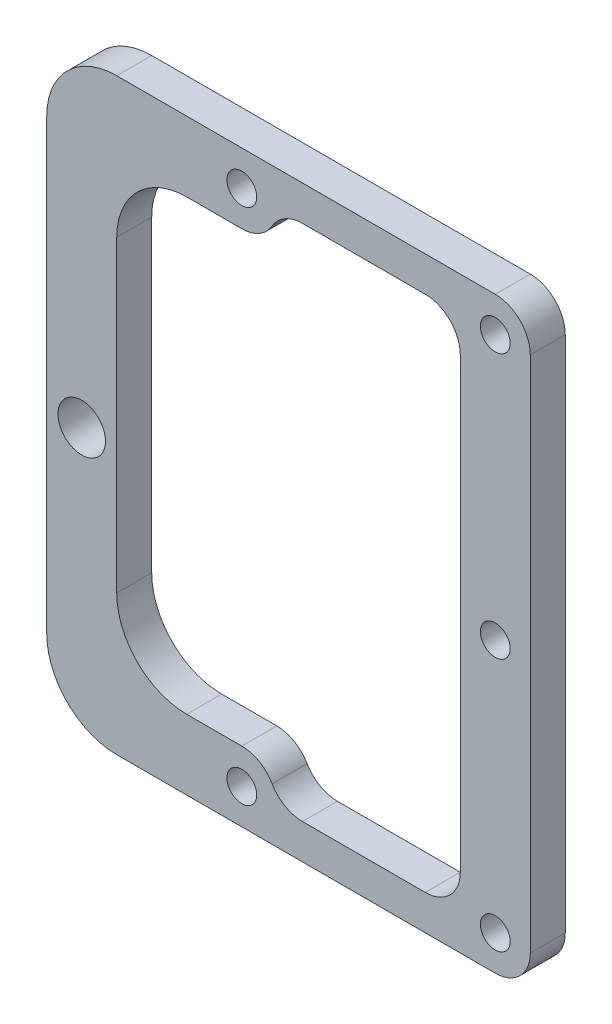
from build123d import *

# Parameters (mm, degrees)
BOSS_EXTRUDE1_DEPTH   = 3.175
F_6_CLEARANCE_HOLE1_D = 4.3053
F_2_CLEARANCE_HOLE1_D = 2.7051
FILLET1_R             = 3.175
FILLET2_R             = 6.35


with BuildPart() as part:
    # Sketch1 → Boss-Extrude1 (new body)
    with BuildSketch(Plane.XY):
        with BuildLine():
            Line((0, 3.175), (-40.698258, 3.175))
            Line((-40.698258, 3.175), (-40.698258, -50.175))
            Line((-40.698258, -50.175), (0, -50.175))
            ThreePointArc((0, -50.175), (2.24506403, -49.24506403), (3.175, -47))
            Line((3.175, -47), (3.175, 0))
            ThreePointArc((3.175, 0), (2.24506403, 2.24506403), (0, 3.175))
        make_face()
        with BuildLine():
            Line((-34.348258, -3.175), (-23, -3.175))
            ThreePointArc((-23, -3.175), (-20.75493597, -2.24506403), (-19.825, 0))
            Line((-19.825, 0), (-3.175, 0))
            Line((-3.175, 0), (-3.175, -47))
            Line((-3.175, -47), (-19.825, -47))
            ThreePointArc((-19.825, -47), (-20.75493597, -44.75493597), (-23, -43.825))
            Line((-23, -43.825), (-34.348258, -43.825))
            Line((-34.348258, -43.825), (-34.348258, -3.175))
        make_face(mode=Mode.SUBTRACT)
    extrude(amount=BOSS_EXTRUDE1_DEPTH)

    # #6 Clearance Hole1 (through all)
    with Locations(Plane.XY.offset(3.175)):
        with Locations((-37.523258, -26.062402)):
            Hole(F_6_CLEARANCE_HOLE1_D / 2)

    # #2 Clearance Hole1 (through all)
    with Locations(Plane.XY.offset(3.175)):
        with Locations((-23, -47), (0, -47), (0, 0), (-23, 0), (0, -24)):
            Hole(F_2_CLEARANCE_HOLE1_D / 2)

    # Fillet1
    fillet1_edges = [part.edges().sort_by_distance(p)[0] for p in [
        (-3.175, -47, 1.5875),
        (-3.175, 0, 1.5875),
        (-19.825, 0, 1.5875),
        (-19.825, -47, 1.5875),
    ]]
    fillet(fillet1_edges, radius=FILLET1_R)

    # Fillet2
    fillet2_edges = [part.edges().sort_by_distance(p)[0] for p in [
        (-40.698258, -50.175, 1.5875),
        (-40.698258, 3.175, 1.5875),
        (-34.348258, -3.175, 1.5875),
        (-34.348258, -43.825, 1.5875),
    ]]
    fillet(fillet2_edges, radius=FILLET2_R)


solid = part.part
